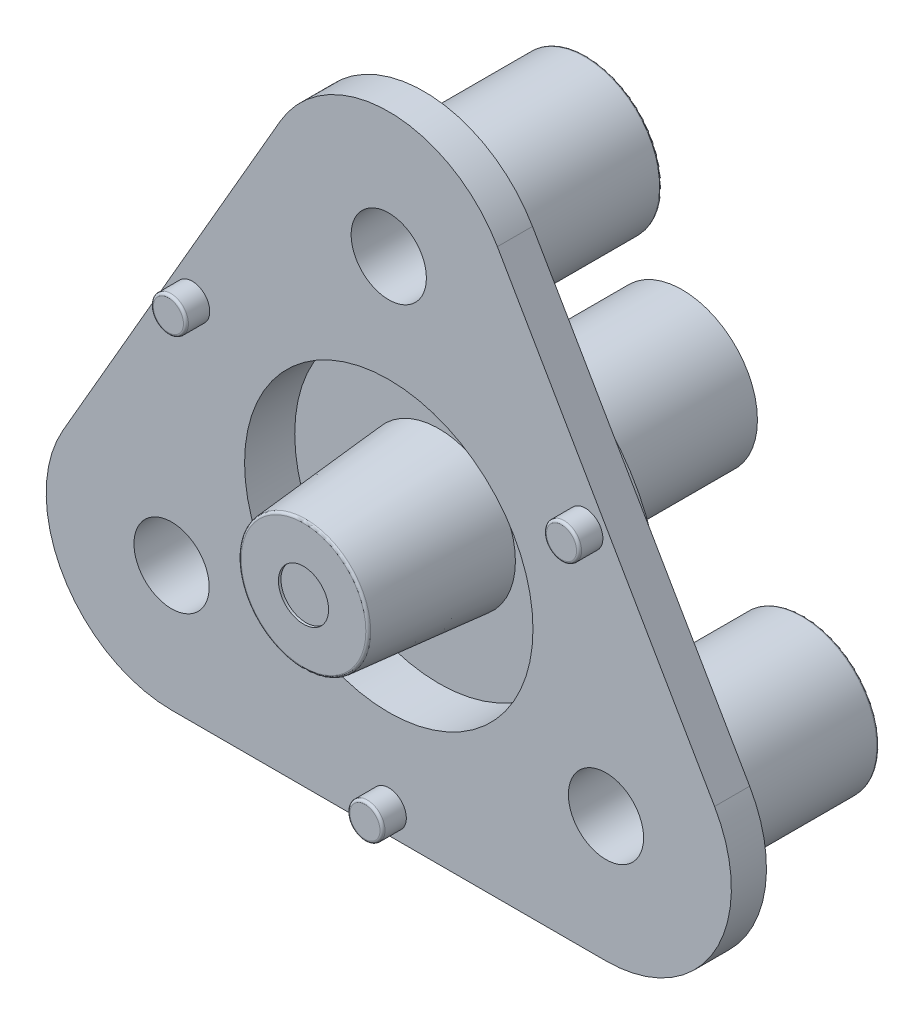
from build123d import *

# Parameters (mm, degrees)
BOSS_EXTRUDE1_DEPTH = 0.7
SKETCH2_R           = 3
BOSS_EXTRUDE2_DEPTH = 6.5
SKETCH3_R           = 7.4
BOSS_EXTRUDE3_DEPTH = 2
SKETCH4_R           = 3
BOSS_EXTRUDE4_DEPTH = 8.3
SKETCH6_R           = 1.5
CUT_EXTRUDE2_DEPTH  = 6.4
SKETCH8_R           = 0.7
BOSS_EXTRUDE5_DEPTH = 0.95
SKETCH9_R           = 5.75
CUT_EXTRUDE3_DEPTH  = 2
SKETCH10_R          = 3.05
BOSS_EXTRUDE6_DEPTH = 5.4
BOSS_EXTRUDE6_TAPER = 5
SKETCH11_R          = 1
CUT_EXTRUDE4_DEPTH  = 0.1
SKETCH5_R           = 1.5
CUT_EXTRUDE1_DEPTH  = 14
FILLET1_R           = 0.1
BOSS_EXTRUDE7_START = -3.5
BOSS_EXTRUDE7_DEPTH = 10.5


with BuildPart() as part:
    # Sketch1 → Boss-Extrude1 (new, symmetric)
    with BuildSketch(Plane.XY):
        with BuildLine():
            Line((12.990381036, -2.499999965), (4.330127061, 12.499999928))
            ThreePointArc((4.330127061, 12.499999928), (-1.88e-07, 15), (-4.330127248, 12.499999603))
            Line((-4.330127248, 12.499999603), (-12.99038047, -2.499998983))
            ThreePointArc((-12.99038047, -2.499998983), (-12.99038135, -7.499999492), (-8.660254038, -10))
            Line((-8.660254038, -10), (8.660254038, -10))
            ThreePointArc((8.660254038, -10), (12.990381067, -7.499999982), (12.990381036, -2.499999965))
        make_face()
    extrude(amount=BOSS_EXTRUDE1_DEPTH, both=True)

    # Sketch2 → Boss-Extrude2 (add)
    with BuildSketch(Plane(origin=(0, 0, -0.7), x_dir=(-1, 0, 0), z_dir=(0, 0, -1))):
        with Locations(Location((0, 10, 0), (0, 0, 180))):
            Circle(SKETCH2_R)
        with Locations(Location((8.660254038, -5, 0), (0, 0, 180))):
            Circle(SKETCH2_R)
        with Locations(Location((-8.660254038, -5, 0), (0, 0, 180))):
            Circle(SKETCH2_R)
    extrude(amount=BOSS_EXTRUDE2_DEPTH)

    # Sketch3 → Boss-Extrude3 (add)
    with BuildSketch(Plane(origin=(0, 0, -0.7), x_dir=(-1, 0, 0), z_dir=(0, 0, -1))):
        Circle(SKETCH3_R)
    extrude(amount=BOSS_EXTRUDE3_DEPTH)

    # Sketch4 → Boss-Extrude4 (add)
    with BuildSketch(Plane(origin=(0, 0, -2.7), x_dir=(-1, 0, 0), z_dir=(0, 0, -1))):
        with Locations(Location((0, 0, 0), (0, 0, 180))):
            Circle(SKETCH4_R)
    extrude(amount=BOSS_EXTRUDE4_DEPTH)

    # Sketch6 → Cut-Extrude2 (cut)
    with BuildSketch(Plane.XY.offset(0.7)):
        with Locations((8.660254038, -5)):
            Circle(SKETCH6_R)
        with Locations((-8.660254038, -5)):
            Circle(SKETCH6_R)
        with Locations((0, 10)):
            Circle(SKETCH6_R)
    extrude(amount=-CUT_EXTRUDE2_DEPTH, mode=Mode.SUBTRACT)

    # Sketch8 → Boss-Extrude5 (add)
    with BuildSketch(Plane.XY.offset(0.7)):
        with Locations(Location((0, -9.05, 0), (0, 0, 180))):
            Circle(SKETCH8_R)
        with Locations(Location((7.837529904, 4.525, 0), (0, 0, 180))):
            Circle(SKETCH8_R)
        with Locations(Location((-7.837529904, 4.525, 0), (0, 0, 180))):
            Circle(SKETCH8_R)
    extrude(amount=BOSS_EXTRUDE5_DEPTH)

    # Sketch9 → Cut-Extrude3 (cut)
    with BuildSketch(Plane.XY.offset(0.7)):
        Circle(SKETCH9_R)
    extrude(amount=-CUT_EXTRUDE3_DEPTH, mode=Mode.SUBTRACT)

    # Sketch10 → Boss-Extrude6 (add)
    with BuildSketch(Plane.XY.offset(-1.3)):
        Circle(SKETCH10_R)
    extrude(amount=BOSS_EXTRUDE6_DEPTH, taper=BOSS_EXTRUDE6_TAPER)

    # Sketch11 → Cut-Extrude4 (cut)
    with BuildSketch(Plane.XY.offset(4.1)):
        Circle(SKETCH11_R)
    extrude(amount=-CUT_EXTRUDE4_DEPTH, mode=Mode.SUBTRACT)

    # Sketch5 → Cut-Extrude1 (cut)
    with BuildSketch(Plane(origin=(0, 0, -11), x_dir=(-1, 0, 0), z_dir=(0, 0, -1))):
        Circle(SKETCH5_R)
    extrude(amount=-CUT_EXTRUDE1_DEPTH, mode=Mode.SUBTRACT)

    # Fillet1
    fillet1_edges = [part.edges().sort_by_distance(p)[0] for p in [
        (-3, 10, -7.2),
        (-11.660254038, -5, -7.2),
        (5.660254038, -5, -7.2),
        (0.7, -9.05, 1.65),
        (8.537529904, 4.525, 1.65),
        (-7.137529904, 4.525, 1.65),
        (-2.577561217, 0, 4.1),
    ]]
    fillet(fillet1_edges, radius=FILLET1_R)

    # Sketch13 → Boss-Extrude7 (add)
    with BuildSketch(Plane(origin=(0, 0, -11), x_dir=(-1, 0, 0), z_dir=(0, 0, -1)).offset(BOSS_EXTRUDE7_START)):
        with BuildLine():
            Line((-0.75, -1.299038106), (-1.5, 0))
            ThreePointArc((-1.5, 0), (-1.299038106, -0.75), (-0.75, -1.299038106))
        make_face()
        with BuildLine():
            Line((0.75, -1.299038106), (-0.75, -1.299038106))
            ThreePointArc((-0.75, -1.299038106), (0, -1.5), (0.75, -1.299038106))
        make_face()
        with BuildLine():
            ThreePointArc((0.75, -1.299038106), (1.299038106, -0.75), (1.5, 0))
            Line((1.5, 0), (0.75, -1.299038106))
        make_face()
        with BuildLine():
            ThreePointArc((1.5, 0), (1.299038106, 0.75), (0.75, 1.299038106))
            Line((0.75, 1.299038106), (1.5, 0))
        make_face()
        with BuildLine():
            ThreePointArc((0.75, 1.299038106), (0, 1.5), (-0.75, 1.299038106))
            Line((-0.75, 1.299038106), (0.75, 1.299038106))
        make_face()
        with BuildLine():
            Line((-1.5, 0), (-0.75, 1.299038106))
            ThreePointArc((-0.75, 1.299038106), (-1.299038106, 0.75), (-1.5, 0))
        make_face()
    extrude(amount=-BOSS_EXTRUDE7_DEPTH)


solid = part.part
